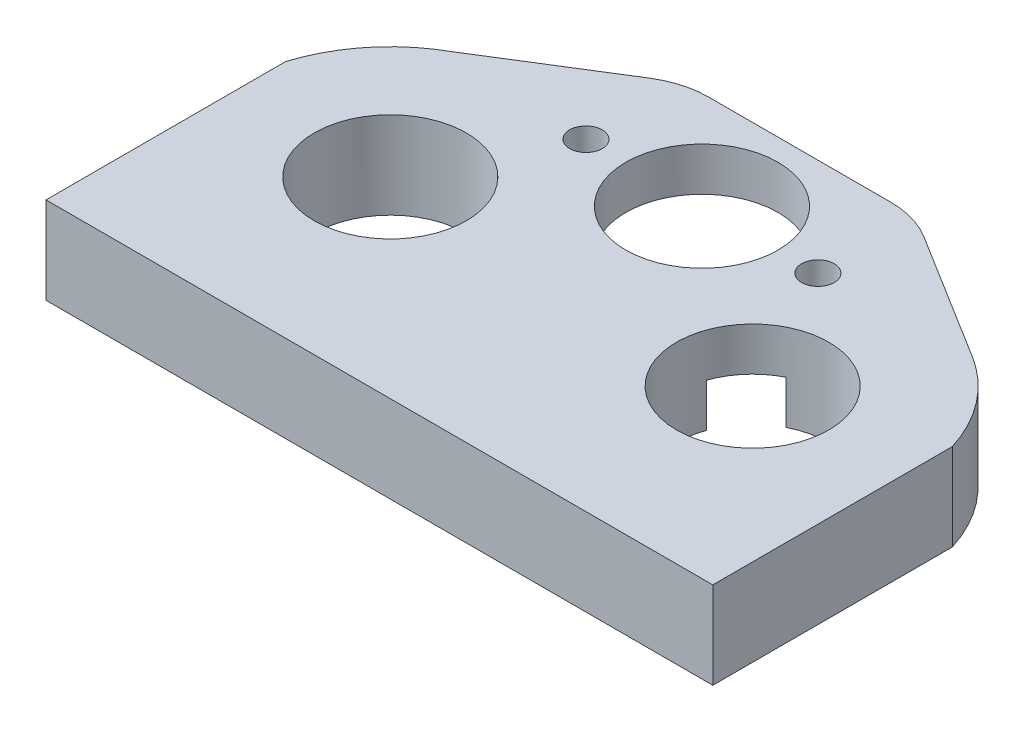
from build123d import *

# Parameters (mm, degrees)
SKETCH1_W           = 92
SKETCH1_H           = 56
BOSS_EXTRUDE1_DEPTH = 12
SKETCH8_W           = 92
SKETCH8_H           = 2
BOSS_EXTRUDE3_DEPTH = 12
CUT_EXTRUDE1_REACH  = 58.214
SKETCH2_R           = 10.5
CUT_EXTRUDE5_REACH  = 58.214
FILLET2_R           = 12
CUT_EXTRUDE6_DEPTH  = 6
CUT_EXTRUDE7_REACH  = 58.214
SKETCH12_R          = 2.25
SKETCH12_R_2        = 10.5


with BuildPart() as part:
    # Sketch1 → Boss-Extrude1 (new body)
    with BuildSketch(Plane(origin=(0, 0, 0), x_dir=(1, 0, 0), z_dir=(0, 1, 0))):
        Rectangle(SKETCH1_W, SKETCH1_H)
    extrude(amount=BOSS_EXTRUDE1_DEPTH)

    # Sketch8 → Boss-Extrude3 (add)
    with BuildSketch(Plane(origin=(0, 12, 0), x_dir=(1, 0, 0), z_dir=(0, 1, 0))):
        with Locations((0, 29)):
            Rectangle(SKETCH8_W, SKETCH8_H)
    extrude(amount=-BOSS_EXTRUDE3_DEPTH)

    # Sketch2 → Cut-Extrude1 (cut, up to next)
    with BuildSketch(Plane(origin=(0, 12, 0), x_dir=(1, 0, 0), z_dir=(0, 1, 0)), mode=Mode.PRIVATE) as cut_extrude1_sk1:
        with Locations(Location((-25, -1.5, 0), (0, 0, 270))):
            Circle(SKETCH2_R)
    cut_extrude1_tool1 = extrude(cut_extrude1_sk1.sketch, amount=-CUT_EXTRUDE1_REACH, mode=Mode.PRIVATE) & part.part
    # Sketch2 → Cut-Extrude1 (cut, up to next)
    with BuildSketch(Plane(origin=(0, 12, 0), x_dir=(1, 0, 0), z_dir=(0, 1, 0)), mode=Mode.PRIVATE) as cut_extrude1_sk2:
        with Locations(Location((25, -1.5, 0), (0, 0, 270))):
            Circle(SKETCH2_R)
    cut_extrude1_tool2 = extrude(cut_extrude1_sk2.sketch, amount=-CUT_EXTRUDE1_REACH, mode=Mode.PRIVATE) & part.part
    add(cut_extrude1_tool1.solids().sort_by_distance((-25, 12, 1.5))[0], mode=Mode.SUBTRACT)
    add(cut_extrude1_tool2.solids().sort_by_distance((25, 12, 1.5))[0], mode=Mode.SUBTRACT)

    # Sketch10 → Cut-Extrude5 (cut, up to next)
    with BuildSketch(Plane(origin=(0, 12, 0), x_dir=(1, 0, 0), z_dir=(0, 1, 0)), mode=Mode.PRIVATE) as cut_extrude5_sk1:
        with BuildLine():
            Line((-46, 5.057438524), (-46, 30))
            Line((-46, 30), (-16, 30))
            Line((-16, 30), (-35.667304108, 17.740806196))
            ThreePointArc((-35.667304108, 17.740806196), (-42.056420822, 12.395269294), (-46, 5.057438524))
        make_face()
    cut_extrude5_tool1 = extrude(cut_extrude5_sk1.sketch, amount=-CUT_EXTRUDE5_REACH, mode=Mode.PRIVATE) & part.part
    # Sketch10 → Cut-Extrude5 (cut, up to next)
    with BuildSketch(Plane(origin=(0, 12, 0), x_dir=(1, 0, 0), z_dir=(0, 1, 0)), mode=Mode.PRIVATE) as cut_extrude5_sk2:
        with BuildLine():
            Line((46, 5.057438524), (46, 30))
            Line((46, 30), (16, 30))
            Line((16, 30), (36.615382461, 17.183760068))
            ThreePointArc((36.615382461, 17.183760068), (42.39835371, 11.964668142), (46, 5.057438524))
        make_face()
    cut_extrude5_tool2 = extrude(cut_extrude5_sk2.sketch, amount=-CUT_EXTRUDE5_REACH, mode=Mode.PRIVATE) & part.part
    add(cut_extrude5_tool1.solids().sort_by_distance((-36.403407, 12, -23.114901))[0], mode=Mode.SUBTRACT)
    add(cut_extrude5_tool2.solids().sort_by_distance((36.411287, 12, -23.11647))[0], mode=Mode.SUBTRACT)

    # Fillet2
    fillet2_edges = [part.edges().sort_by_distance(p)[0] for p in [
        (-16, 6, -30),
        (16, 6, -30),
    ]]
    fillet(fillet2_edges, radius=FILLET2_R)

    # Sketch11 → Cut-Extrude6 (cut)
    with BuildSketch(Plane.XZ):
        with BuildLine():
            Line((22, -16.5), (22, -26.269899929))
            Line((22, -26.269899929), (16.545392108, -31))
            Line((16.545392108, -31), (-16.545392108, -31))
            Line((-16.545392108, -31), (-22, -26.260028196))
            Line((-22, -26.260028196), (-22, -16.5))
            ThreePointArc((-22, -16.5), (-20.591243605, -8.753988974), (-16.545392108, -2))
            Line((-16.545392108, -2), (16.545392108, -2))
            ThreePointArc((16.545392108, -2), (20.591243605, -8.753988974), (22, -16.5))
        make_face()
    extrude(amount=-CUT_EXTRUDE6_DEPTH, mode=Mode.SUBTRACT)

    # Sketch12 → Cut-Extrude7 (cut, up to next)
    with BuildSketch(Plane.XZ, mode=Mode.PRIVATE) as cut_extrude7_sk1:
        with Locations(Location((16, -16.5, 0), (0, 0, 270))):
            Circle(SKETCH12_R)
    cut_extrude7_tool1 = extrude(cut_extrude7_sk1.sketch, amount=-CUT_EXTRUDE7_REACH, mode=Mode.PRIVATE) & part.part
    # Sketch12 → Cut-Extrude7 (cut, up to next)
    with BuildSketch(Plane.XZ, mode=Mode.PRIVATE) as cut_extrude7_sk2:
        with Locations(Location((-16, -16.5, 0), (0, 0, 270))):
            Circle(SKETCH12_R)
    cut_extrude7_tool2 = extrude(cut_extrude7_sk2.sketch, amount=-CUT_EXTRUDE7_REACH, mode=Mode.PRIVATE) & part.part
    # Sketch12 → Cut-Extrude7 (cut, up to next)
    with BuildSketch(Plane.XZ, mode=Mode.PRIVATE) as cut_extrude7_sk3:
        with Locations(Location((0, -16.5, 0), (0, 0, 270))):
            Circle(SKETCH12_R_2)
    cut_extrude7_tool3 = extrude(cut_extrude7_sk3.sketch, amount=-CUT_EXTRUDE7_REACH, mode=Mode.PRIVATE) & part.part
    add(cut_extrude7_tool1.solids().sort_by_distance((16, 0, -16.5))[0], mode=Mode.SUBTRACT)
    add(cut_extrude7_tool2.solids().sort_by_distance((-16, 0, -16.5))[0], mode=Mode.SUBTRACT)
    add(cut_extrude7_tool3.solids().sort_by_distance((0, 0, -16.5))[0], mode=Mode.SUBTRACT)


solid = part.part
